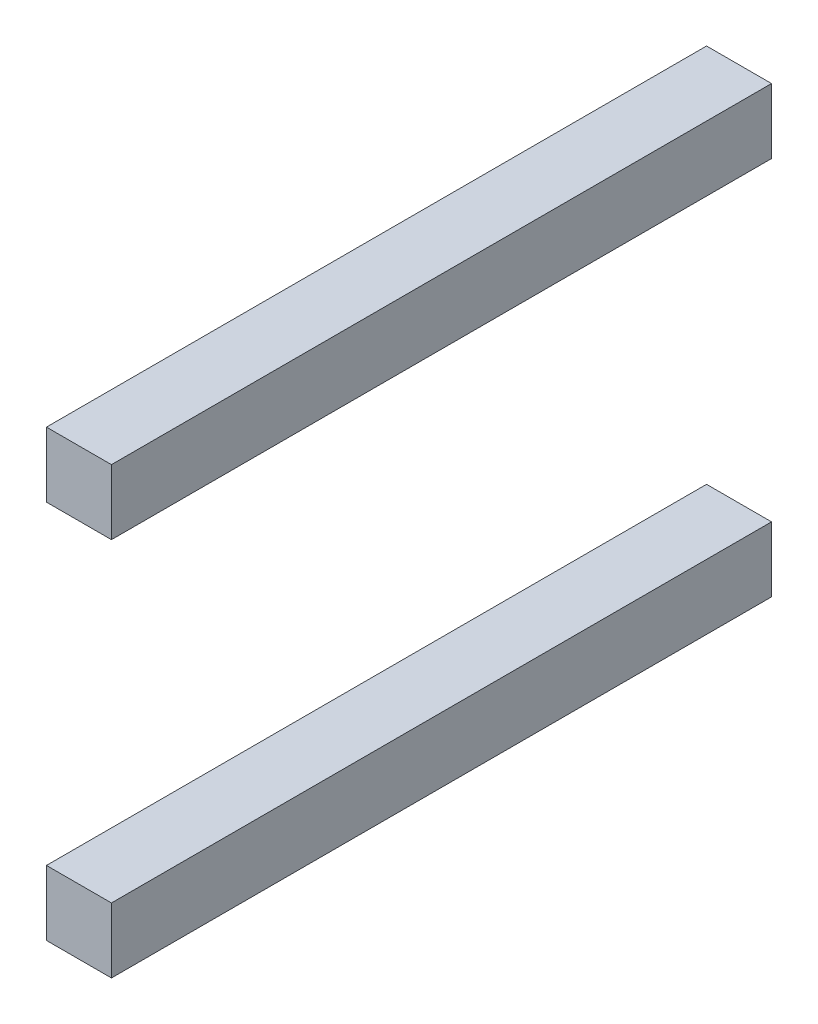
from build123d import *

# Parameters (mm, degrees)
SKETCH1_W             = 9.525
SKETCH1_H             = 9.525
BOSS_EXTRUDE1_DEPTH   = 96.731666667
BOSS_EXTRUDE1_2_DEPTH = 96.731666667


with BuildPart() as part:
    # Sketch1 → Boss-Extrude1 (new body)
    with BuildSketch(Plane.XY):
        with Locations((8.715704544, 72.263)):
            Rectangle(SKETCH1_W, SKETCH1_H)
    extrude(amount=BOSS_EXTRUDE1_DEPTH)


with BuildPart() as body_2:
    # Sketch1 → Boss-Extrude1 2 (new body)
    with BuildSketch(Plane.XY):
        with Locations((8.715704544, 16.637)):
            Rectangle(SKETCH1_W, SKETCH1_H)
    extrude(amount=BOSS_EXTRUDE1_2_DEPTH)


solid = Compound([part.part, body_2.part])
